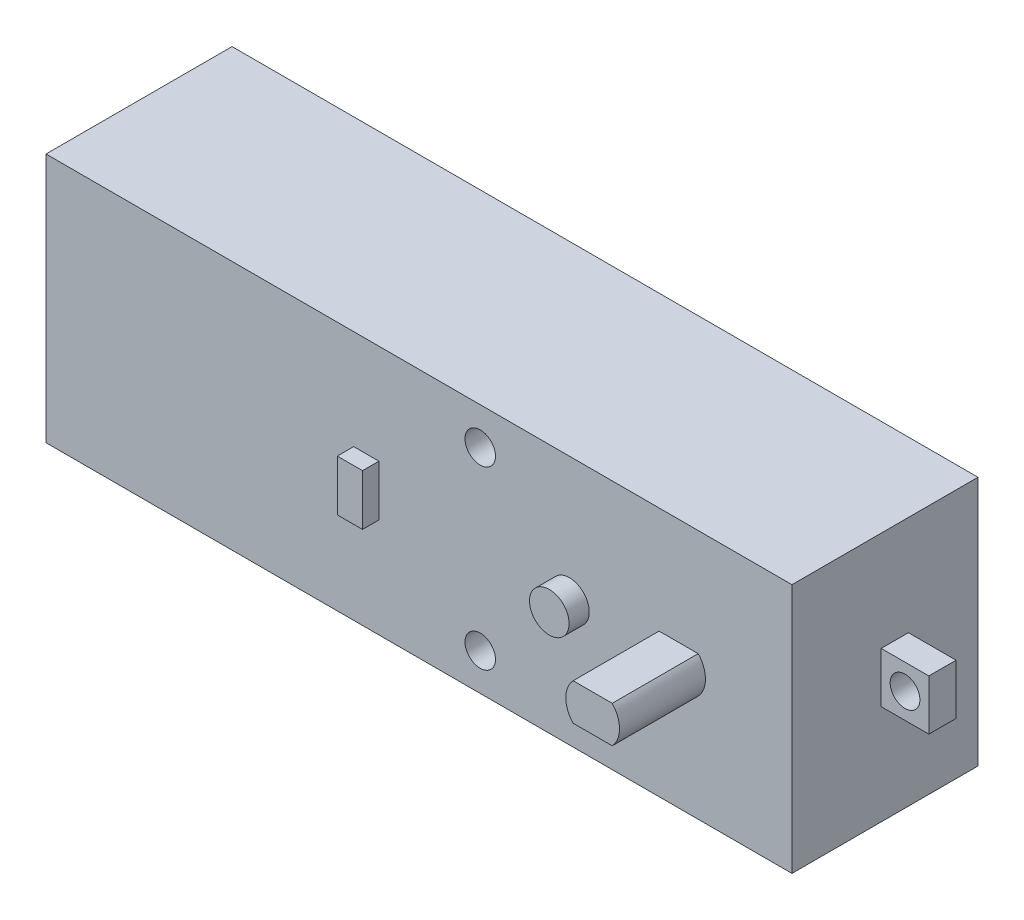
from build123d import *

# Parameters (mm, degrees)
SKETCH1_W           = 75.1586
SKETCH1_H           = 25.1968
BOSS_EXTRUDE1_DEPTH = 18.7452
SKETCH2_W           = 4.8006
SKETCH2_H           = 5.08
BOSS_EXTRUDE2_DEPTH = 2.7432
SKETCH4_R           = 1.4986
CUT_EXTRUDE1_DEPTH  = 85.400741157
SKETCH3_R           = 1.9939
BOSS_EXTRUDE3_DEPTH = 2.032
SKETCH5_R           = 2.7051
BOSS_EXTRUDE4_DEPTH = 8.6614
CUT_EXTRUDE2_START  = -8.6614
CUT_EXTRUDE2_DEPTH  = 8.6614
SKETCH7_R           = 1.5367
CUT_EXTRUDE3_DEPTH  = 86.905383521
SKETCH8_W           = 2.54
SKETCH8_H           = 5.1308
BOSS_EXTRUDE5_DEPTH = 1.651


with BuildPart() as part:
    # Sketch1 → Boss-Extrude1 (new body)
    with BuildSketch(Plane.XY):
        with Locations((37.5793, 12.5984)):
            Rectangle(SKETCH1_W, SKETCH1_H)
    extrude(amount=BOSS_EXTRUDE1_DEPTH)

    # Sketch2 → Boss-Extrude2 (add)
    with BuildSketch(Plane.XY.offset(7.0104)):
        with Locations((77.5589, 12.5984)):
            Rectangle(SKETCH2_W, SKETCH2_H)
    extrude(amount=BOSS_EXTRUDE2_DEPTH)

    # Sketch4 → Cut-Extrude1 (cut, through all)
    with BuildSketch(Plane.XY.offset(9.7536)):
        with Locations((77.5589, 12.5984)):
            Circle(SKETCH4_R)
    extrude(amount=-CUT_EXTRUDE1_DEPTH, mode=Mode.SUBTRACT)

    # Sketch3 → Boss-Extrude3 (add)
    with BuildSketch(Plane.XY.offset(18.7452)):
        with Locations(Location((52.7431, 12.5984, 0), (0, 0, 180))):
            Circle(SKETCH3_R)
    extrude(amount=BOSS_EXTRUDE3_DEPTH)

    # Sketch5 → Boss-Extrude4 (add)
    with BuildSketch(Plane.XY.offset(18.7452)):
        with Locations(Location((63.7413, 12.5984, 0), (0, 0, 180))):
            Circle(SKETCH5_R)
    extrude(amount=BOSS_EXTRUDE4_DEPTH)

    # Sketch6 → Cut-Extrude2 (cut)
    with BuildSketch(Plane.XY.offset(27.4066).offset(CUT_EXTRUDE2_START)):
        with BuildLine():
            ThreePointArc((65.710946763, 14.4526), (63.7413, 15.3035), (61.771653237, 14.4526))
            Line((61.771653237, 14.4526), (65.710946763, 14.4526))
        make_face()
        with BuildLine():
            Line((65.710946763, 10.7442), (61.771653237, 10.7442))
            ThreePointArc((61.771653237, 10.7442), (63.7413, 9.8933), (65.710946763, 10.7442))
        make_face()
    extrude(amount=CUT_EXTRUDE2_DEPTH, mode=Mode.SUBTRACT)

    # Sketch7 → Cut-Extrude3 (cut, through all)
    with BuildSketch(Plane.XY.offset(18.7452)):
        with Locations((43.7515, 21.463)):
            Circle(SKETCH7_R)
        with Locations((43.7515, 3.7338)):
            Circle(SKETCH7_R)
    extrude(amount=-CUT_EXTRUDE3_DEPTH, mode=Mode.SUBTRACT)

    # Sketch8 → Boss-Extrude5 (add)
    with BuildSketch(Plane.XY.offset(18.7452)):
        with Locations((32.2707, 12.5984)):
            Rectangle(SKETCH8_W, SKETCH8_H)
    extrude(amount=BOSS_EXTRUDE5_DEPTH)


solid = part.part
